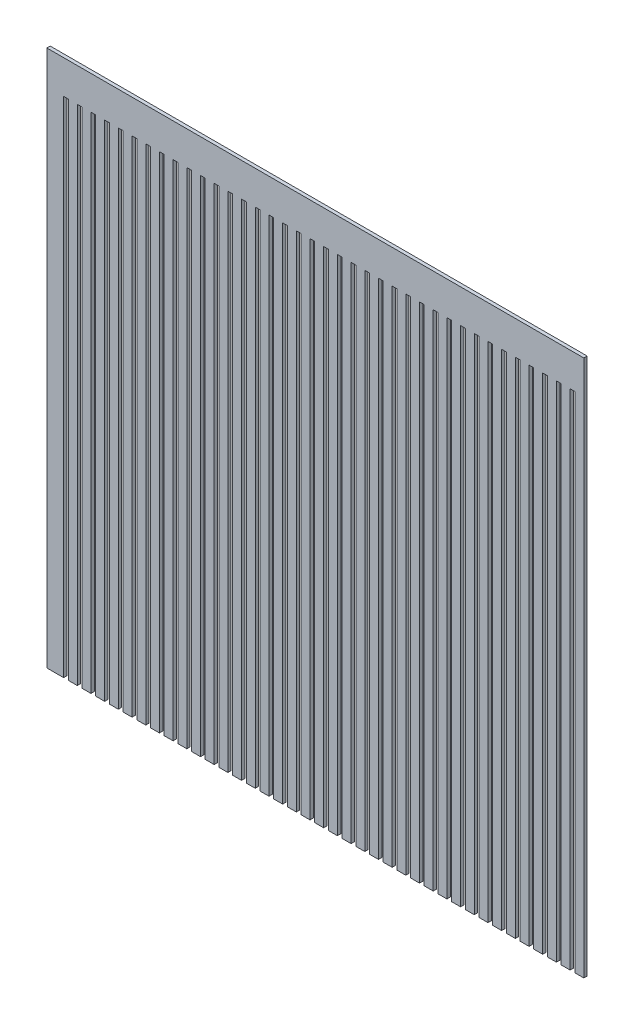
from build123d import *

# Parameters (mm, degrees)
EXTRUDE_2_DEPTH = 1


with BuildPart() as part:
    # 草图1 → 凸台-拉伸2 (new body)
    with BuildSketch(Plane.XY):
        Polygon((-74.992657391, 70), (-74.992657391, -80), (-79.992657391, -80), (-79.992657391, 80), (80.007342609, 80), (80.007342609, -80), (77.328395241, -80), (77.328395241, 70), (75.928395241, 70), (75.928395241, -80), (73.249447872, -80), (73.249447872, 70), (71.849447872, 70), (71.849447872, -80), (69.170500504, -80), (69.170500504, 70), (67.770500504, 70), (67.770500504, -80), (65.091553135, -80), (65.091553135, 70), (63.691553135, 70), (63.691553135, -80), (61.012605767, -80), (61.012605767, 70), (59.612605767, 70), (59.612605767, -80), (56.933658398, -80), (56.933658398, 70), (55.533658398, 70), (55.533658398, -80), (52.85471103, -80), (52.85471103, 70), (51.45471103, 70), (51.45471103, -80), (48.775763662, -80), (48.775763662, 70), (47.375763662, 70), (47.375763662, -80), (44.696816293, -80), (44.696816293, 70), (43.296816293, 70), (43.296816293, -80), (40.617868925, -80), (40.617868925, 70), (39.217868925, 70), (39.217868925, -80), (36.538921556, -80), (36.538921556, 70), (35.138921556, 70), (35.138921556, -80), (32.459974188, -80), (32.459974188, 70), (31.059974188, 70), (31.059974188, -80), (28.381026819, -80), (28.381026819, 70), (26.981026819, 70), (26.981026819, -80), (24.302079451, -80), (24.302079451, 70), (22.902079451, 70), (22.902079451, -80), (20.223132083, -80), (20.223132083, 70), (18.823132083, 70), (18.823132083, -80), (16.144184714, -80), (16.144184714, 70), (14.744184714, 70), (14.744184714, -80), (12.065237346, -80), (12.065237346, 70), (10.665237346, 70), (10.665237346, -80), (7.986289977, -80), (7.986289977, 70), (6.586289977, 70), (6.586289977, -80), (3.907342609, -80), (3.907342609, 70), (2.507342609, 70), (2.507342609, -80), (-0.171604759, -80), (-0.171604759, 70), (-1.571604759, 70), (-1.571604759, -80), (-4.250552128, -80), (-4.250552128, 70), (-5.650552128, 70), (-5.650552128, -80), (-8.329499496, -80), (-8.329499496, 70), (-9.729499496, 70), (-9.729499496, -80), (-12.408446865, -80), (-12.408446865, 70), (-13.808446865, 70), (-13.808446865, -80), (-16.487394233, -80), (-16.487394233, 70), (-17.887394233, 70), (-17.887394233, -80), (-20.566341602, -80), (-20.566341602, 70), (-21.966341602, 70), (-21.966341602, -80), (-24.64528897, -80), (-24.64528897, 70), (-26.04528897, 70), (-26.04528897, -80), (-28.724236338, -80), (-28.724236338, 70), (-30.124236338, 70), (-30.124236338, -80), (-32.803183707, -80), (-32.803183707, 70), (-34.203183707, 70), (-34.203183707, -80), (-36.882131075, -80), (-36.882131075, 70), (-38.282131075, 70), (-38.282131075, -80), (-40.961078444, -80), (-40.961078444, 70), (-42.361078444, 70), (-42.361078444, -80), (-45.040025812, -80), (-45.040025812, 70), (-46.440025812, 70), (-46.440025812, -80), (-49.118973181, -80), (-49.118973181, 70), (-50.518973181, 70), (-50.518973181, -80), (-53.197920549, -80), (-53.197920549, 70), (-54.597920549, 70), (-54.597920549, -80), (-57.276867917, -80), (-57.276867917, 70), (-58.676867917, 70), (-58.676867917, -80), (-61.355815286, -80), (-61.355815286, 70), (-62.755815286, 70), (-62.755815286, -80), (-65.434762654, -80), (-65.434762654, 70), (-66.834762654, 70), (-66.834762654, -80), (-69.513710023, -80), (-69.513710023, 70), (-70.913710023, 70), (-70.913710023, -80), (-73.592657391, -80), (-73.592657391, 70), align=None)
    extrude(amount=EXTRUDE_2_DEPTH)


solid = part.part
